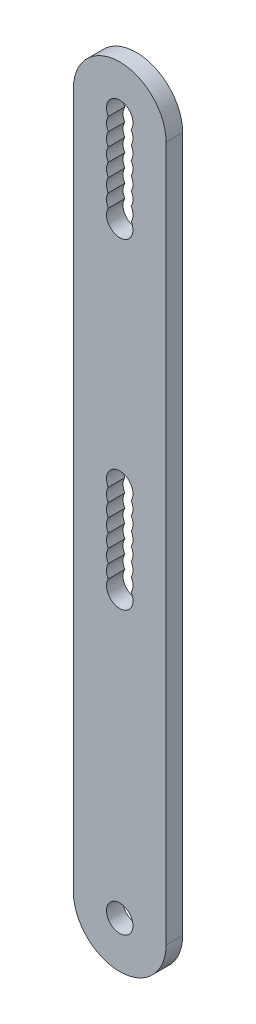
from build123d import *

# Parameters (mm, degrees)
SKETCH1_R           = 4
BOSS_EXTRUDE1_DEPTH = 2.5


with BuildPart() as part:
    # Sketch1 → Boss-Extrude1 (new, symmetric)
    with BuildSketch(Plane(origin=(0, 0, 0), x_dir=(0, 1, 0), z_dir=(0, 0, 1))):
        with BuildLine():
            Line((105, 14), (-105, 14))
            ThreePointArc((-105, 14), (-119, 0), (-105, -14))
            Line((-105, -14), (105, -14))
            ThreePointArc((105, -14), (119, 0), (105, 14))
        make_face()
        with Locations(Location((-105, 0, 0), (0, 0, 270))):
            Circle(SKETCH1_R, mode=Mode.SUBTRACT)
        with BuildLine():
            ThreePointArc((-2, 3.464101615), (0, 4), (2, 3.464101615))
            ThreePointArc((2, 3.464101615), (4, 4), (6, 3.464101615))
            ThreePointArc((6, 3.464101615), (10, 3.464101615), (12, 0))
            ThreePointArc((12, 0), (10, -3.464101615), (6, -3.464101615))
            ThreePointArc((6, -3.464101615), (4, -4), (2, -3.464101615))
            ThreePointArc((2, -3.464101615), (0, -4), (-2, -3.464101615))
            ThreePointArc((-2, -3.464101615), (-4, -4), (-6, -3.464101615))
            ThreePointArc((-6, -3.464101615), (-8, -4), (-10, -3.464101615))
            ThreePointArc((-10, -3.464101615), (-12, -4), (-14, -3.464101615))
            ThreePointArc((-14, -3.464101615), (-16, -4), (-18, -3.464101615))
            ThreePointArc((-18, -3.464101615), (-24, 0), (-18, 3.464101615))
            ThreePointArc((-18, 3.464101615), (-16, 4), (-14, 3.464101615))
            ThreePointArc((-14, 3.464101615), (-12, 4), (-10, 3.464101615))
            ThreePointArc((-10, 3.464101615), (-8, 4), (-6, 3.464101615))
            ThreePointArc((-6, 3.464101615), (-4, 4), (-2, 3.464101615))
        make_face(mode=Mode.SUBTRACT)
        with BuildLine():
            ThreePointArc((103, 3.464101615), (109, 0), (103, -3.464101615))
            ThreePointArc((103, -3.464101615), (101, -4), (99, -3.464101615))
            ThreePointArc((99, -3.464101615), (97, -4), (95, -3.464101615))
            ThreePointArc((95, -3.464101615), (93, -4), (91, -3.464101615))
            ThreePointArc((91, -3.464101615), (89, -4), (87, -3.464101615))
            ThreePointArc((87, -3.464101615), (85, -4), (83, -3.464101615))
            ThreePointArc((83, -3.464101615), (81, -4), (79, -3.464101615))
            ThreePointArc((79, -3.464101615), (73, 0), (79, 3.464101615))
            ThreePointArc((79, 3.464101615), (81, 4), (83, 3.464101615))
            ThreePointArc((83, 3.464101615), (85, 4), (87, 3.464101615))
            ThreePointArc((87, 3.464101615), (89, 4), (91, 3.464101615))
            ThreePointArc((91, 3.464101615), (93, 4), (95, 3.464101615))
            ThreePointArc((95, 3.464101615), (97, 4), (99, 3.464101615))
            ThreePointArc((99, 3.464101615), (101, 4), (103, 3.464101615))
        make_face(mode=Mode.SUBTRACT)
    extrude(amount=BOSS_EXTRUDE1_DEPTH, both=True)


solid = part.part
